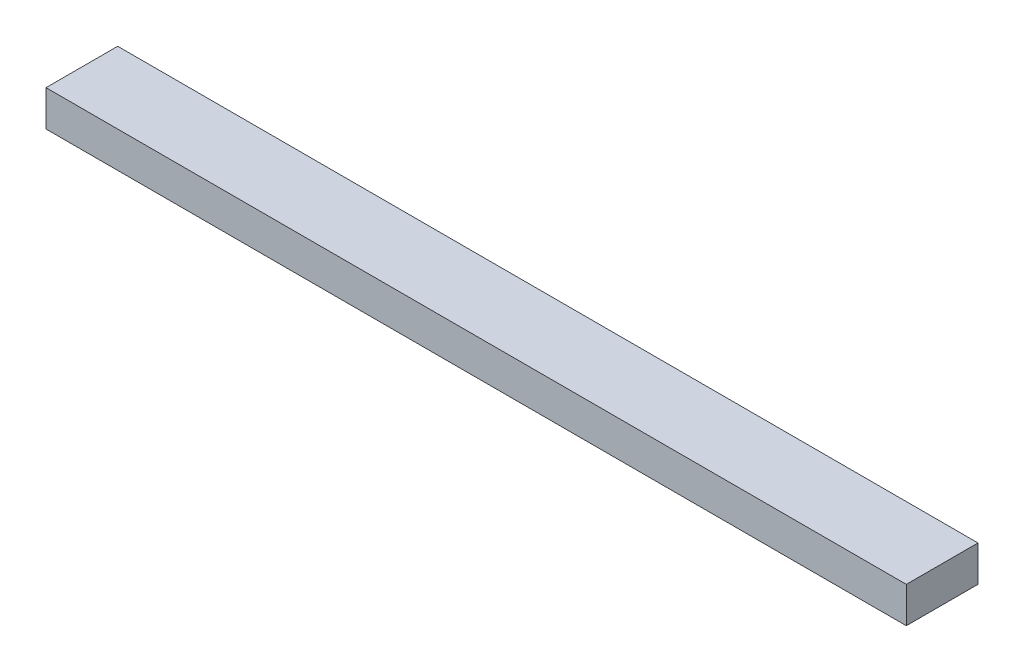
from build123d import *

# Parameters (mm, degrees)
SKETCH1_W           = 101.6
SKETCH1_H           = 50.8
BOSS_EXTRUDE1_DEPTH = 1219.2


with BuildPart() as part:
    # Sketch1 → Boss-Extrude1 (new body)
    with BuildSketch(Plane(origin=(0, 0, 0), x_dir=(0, 0, -1), z_dir=(1, 0, 0))):
        Rectangle(SKETCH1_W, SKETCH1_H)
    extrude(amount=BOSS_EXTRUDE1_DEPTH)


solid = part.part
